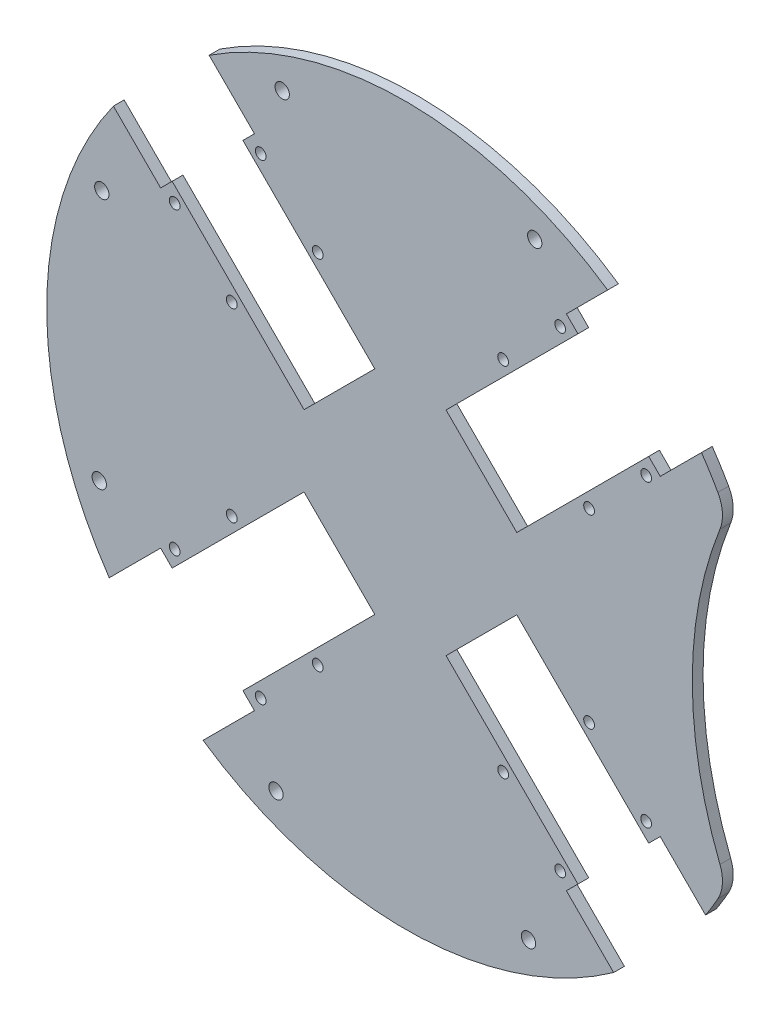
from build123d import *

# Parameters (mm, degrees)
CROQUIS1_R              = 100
SALIENTE_EXTRUIR1_DEPTH = 3
CROQUIS3_R              = 110
CORTAR_EXTRUIR1_DEPTH   = 3
REDONDEO1_R             = 10
CORTAR_EXTRUIR2_DEPTH   = 142.453172607
CROQUIS5_R              = 1.5
CORTAR_EXTRUIR3_DEPTH   = 10
CROQUIS6_R              = 2
CORTAR_EXTRUIR4_DEPTH   = 142.453172607


with BuildPart() as part:
    # Croquis1 → Saliente-Extruir1 (new body)
    with BuildSketch(Plane.XY):
        Circle(CROQUIS1_R)
    extrude(amount=SALIENTE_EXTRUIR1_DEPTH)

    # Croquis3 → Cortar-Extruir1 (cut)
    with BuildSketch(Plane.XY.offset(3)):
        with Locations((190, 0)):
            Circle(CROQUIS3_R)
    extrude(amount=-CORTAR_EXTRUIR1_DEPTH, mode=Mode.SUBTRACT)

    # Redondeo1
    redondeo1_edges = [part.edges().sort_by_distance(p)[0] for p in [
        (89.473684211, -44.659375654, 1.5),
        (89.473684211, 44.659375654, 1.5),
    ]]
    fillet(redondeo1_edges, radius=REDONDEO1_R)

    # Croquis4 → Cortar-Extruir2 (cut, through all)
    with BuildSketch(Plane.XY.offset(3)):
        Polygon((-83.792153571, -57.629202667), (-57.629202667, -83.792153571), (-42.072853481, -68.235804385), (-45.290189335, -65.01846853), (-8.520636713, -28.248915908), (-28.248915908, -8.520636713), (-65.01846853, -45.290189335), (-68.235804385, -42.072853481), align=None)
        Polygon((-8.520636713, 31.077343033), (-28.248915908, 11.349063838), (-65.01846853, 48.11861646), (-68.235804385, 44.901280605), (-83.792153571, 60.457629791), (-57.629202667, 86.620580695), (-42.072853481, 71.064231509), (-45.290189335, 67.846895655), align=None)
        Polygon((31.077343033, 11.349063838), (11.349063838, 31.077343033), (48.11861646, 67.846895655), (44.901280605, 71.064231509), (60.457629791, 86.620580695), (86.620580695, 60.457629791), (71.064231509, 44.901280605), (67.846895655, 48.11861646), align=None)
        Polygon((11.349063838, -28.248915908), (31.077343033, -8.520636713), (67.846895655, -45.290189335), (71.064231509, -42.072853481), (86.620580695, -57.629202667), (60.457629791, -83.792153571), (44.901280605, -68.235804385), (48.11861646, -65.01846853), align=None)
    extrude(amount=-CORTAR_EXTRUIR2_DEPTH, mode=Mode.SUBTRACT)

    # Croquis5 → Cortar-Extruir3 (cut)
    with BuildSketch(Plane.XY.offset(3)):
        with Locations((-64.311361749, -40.340441867)):
            Circle(CROQUIS5_R)
        with Locations((-48.401459172, -24.43053929)):
            Circle(CROQUIS5_R)
        with Locations((-24.43053929, -48.401459172)):
            Circle(CROQUIS5_R)
        with Locations((-40.340441867, -64.311361749)):
            Circle(CROQUIS5_R)
        with Locations((-24.43053929, 51.229886297)):
            Circle(CROQUIS5_R)
        with Locations((-40.340441867, 67.139788874)):
            Circle(CROQUIS5_R)
        with Locations((-48.401459172, 27.258966415)):
            Circle(CROQUIS5_R)
        with Locations((-64.311361749, 43.168868991)):
            Circle(CROQUIS5_R)
        with Locations((51.229886297, 27.258966415)):
            Circle(CROQUIS5_R)
        with Locations((67.139788874, 43.168868991)):
            Circle(CROQUIS5_R)
        with Locations((27.258966415, 51.229886297)):
            Circle(CROQUIS5_R)
        with Locations((43.168868991, 67.139788874)):
            Circle(CROQUIS5_R)
        with Locations((27.258966415, -48.401459172)):
            Circle(CROQUIS5_R)
        with Locations((43.168868991, -64.311361749)):
            Circle(CROQUIS5_R)
        with Locations((51.229886297, -24.43053929)):
            Circle(CROQUIS5_R)
        with Locations((67.139788874, -40.340441867)):
            Circle(CROQUIS5_R)
    extrude(amount=-CORTAR_EXTRUIR3_DEPTH, mode=Mode.SUBTRACT)

    # Croquis6 → Cortar-Extruir4 (cut, through all)
    with BuildSketch(Plane(origin=(0, 0, 0), x_dir=(-1, 0, 0), z_dir=(0, 0, -1))):
        with Locations((-36.071652756, 84.633538668)):
            Circle(CROQUIS6_R)
        with Locations((34.338438835, 85.35145938)):
            Circle(CROQUIS6_R)
        with Locations((84.633538668, 36.071652756)):
            Circle(CROQUIS6_R)
        with Locations((85.35145938, -34.338438835)):
            Circle(CROQUIS6_R)
        with Locations((36.071652756, -84.633538668)):
            Circle(CROQUIS6_R)
        with Locations((-34.338438835, -85.35145938)):
            Circle(CROQUIS6_R)
    extrude(amount=-CORTAR_EXTRUIR4_DEPTH, mode=Mode.SUBTRACT)


solid = part.part
